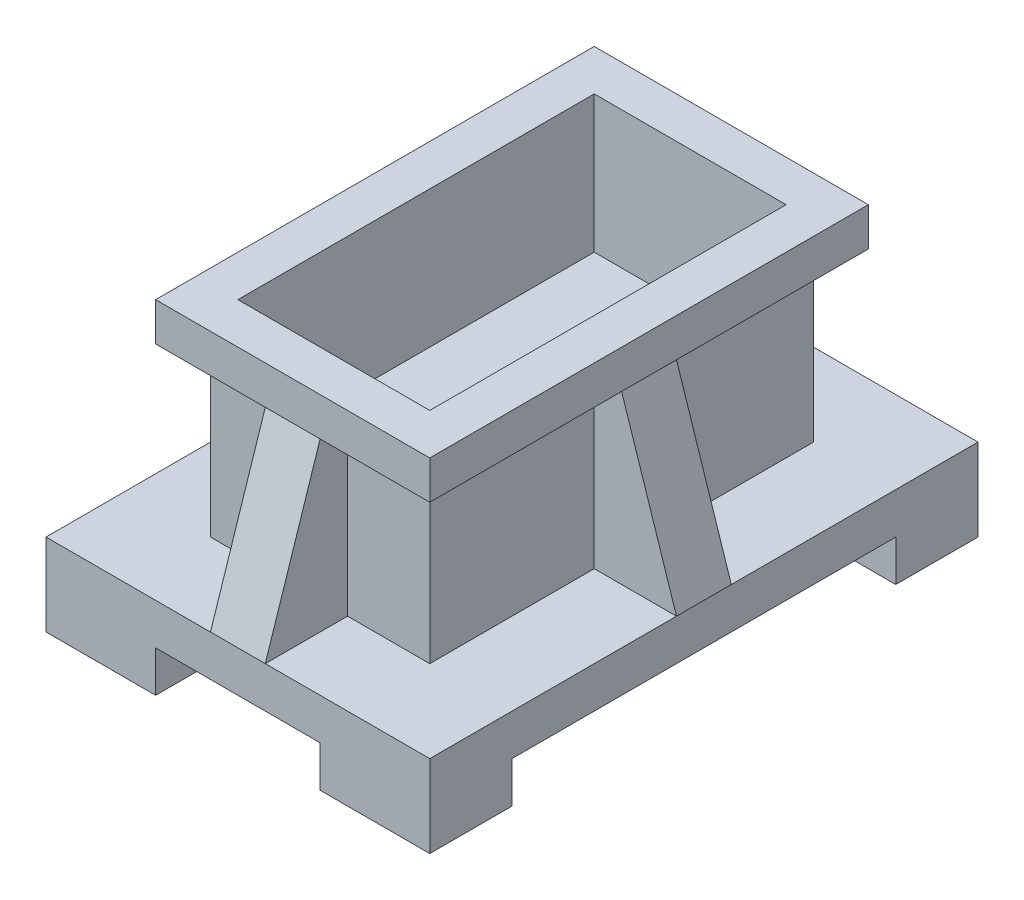
from build123d import *

# Parameters (mm, degrees)
SKETCH1_W           = 140
SKETCH1_H           = 200
BOSS_EXTRUDE1_DEPTH = 30
SKETCH2_W           = 140
SKETCH2_H           = 15
CUT_EXTRUDE1_DEPTH  = 175.642491966
SKETCH3_W           = 60
SKETCH3_H           = 15
CUT_EXTRUDE3_DEPTH  = 215.00934559
SKETCH4_W           = 80
SKETCH4_H           = 140
BOSS_EXTRUDE3_DEPTH = 61
SKETCH5_W           = 100
SKETCH5_H           = 160
SKETCH5_W_2         = 70
SKETCH5_H_2         = 130
BOSS_EXTRUDE4_DEPTH = 14
SKETCH7_W           = 70
SKETCH7_H           = 130
CUT_EXTRUDE4_DEPTH  = 36
BOSS_EXTRUDE5_DEPTH = 10
BOSS_EXTRUDE6_DEPTH = 10


with BuildPart() as part:
    # Sketch1 → Boss-Extrude1 (new body)
    with BuildSketch(Plane(origin=(0, 0, 0), x_dir=(1, 0, 0), z_dir=(0, 1, 0))):
        Rectangle(SKETCH1_W, SKETCH1_H)
    extrude(amount=BOSS_EXTRUDE1_DEPTH)

    # Sketch2 → Cut-Extrude1 (cut, through all)
    with BuildSketch(Plane(origin=(70, 0, 0), x_dir=(0, 0, -1), z_dir=(1, 0, 0))):
        with Locations((0, 7.5)):
            Rectangle(SKETCH2_W, SKETCH2_H)
    extrude(amount=-CUT_EXTRUDE1_DEPTH, mode=Mode.SUBTRACT)

    # Sketch3 → Cut-Extrude3 (cut, through all)
    with BuildSketch(Plane.XY.offset(100)):
        with Locations((0, 7.5)):
            Rectangle(SKETCH3_W, SKETCH3_H)
    extrude(amount=-CUT_EXTRUDE3_DEPTH, mode=Mode.SUBTRACT)

    # Sketch4 → Boss-Extrude3 (add)
    with BuildSketch(Plane(origin=(0, 30, 0), x_dir=(1, 0, 0), z_dir=(0, 1, 0))):
        Rectangle(SKETCH4_W, SKETCH4_H)
    extrude(amount=BOSS_EXTRUDE3_DEPTH)

    # Sketch5 → Boss-Extrude4 (add)
    with BuildSketch(Plane(origin=(0, 91, 0), x_dir=(1, 0, 0), z_dir=(0, 1, 0))):
        Rectangle(SKETCH5_W, SKETCH5_H)
        Rectangle(SKETCH5_W_2, SKETCH5_H_2, mode=Mode.SUBTRACT)
    extrude(amount=BOSS_EXTRUDE4_DEPTH)

    # Sketch7 → Cut-Extrude4 (cut)
    with BuildSketch(Plane(origin=(0, 91, 0), x_dir=(1, 0, 0), z_dir=(0, 1, 0))):
        Rectangle(SKETCH7_W, SKETCH7_H)
    extrude(amount=-CUT_EXTRUDE4_DEPTH, mode=Mode.SUBTRACT)

    # Sketch9 → Boss-Extrude5 (add, symmetric)
    with BuildSketch(Plane.XY):
        Polygon((-50, 91), (-70, 30), (-39.979727261, 30), (-40, 91), align=None)
    boss_extrude5 = extrude(amount=BOSS_EXTRUDE5_DEPTH, both=True)

    # Mirror1: Boss-Extrude5 across plane
    add(boss_extrude5.mirror(Plane(origin=(0, 0, 0), x_dir=(0, 0, 1), z_dir=(1, 0, 0))))

    # Sketch10 → Boss-Extrude6 (add, symmetric)
    with BuildSketch(Plane(origin=(0, 0, 0), x_dir=(0, 0, -1), z_dir=(1, 0, 0))):
        Polygon((-70, 91), (-80, 91), (-100, 30), (-70, 30), align=None)
    boss_extrude6 = extrude(amount=BOSS_EXTRUDE6_DEPTH, both=True)

    # Mirror2: Boss-Extrude6 across plane
    add(boss_extrude6.mirror(Plane.XY))


solid = part.part
